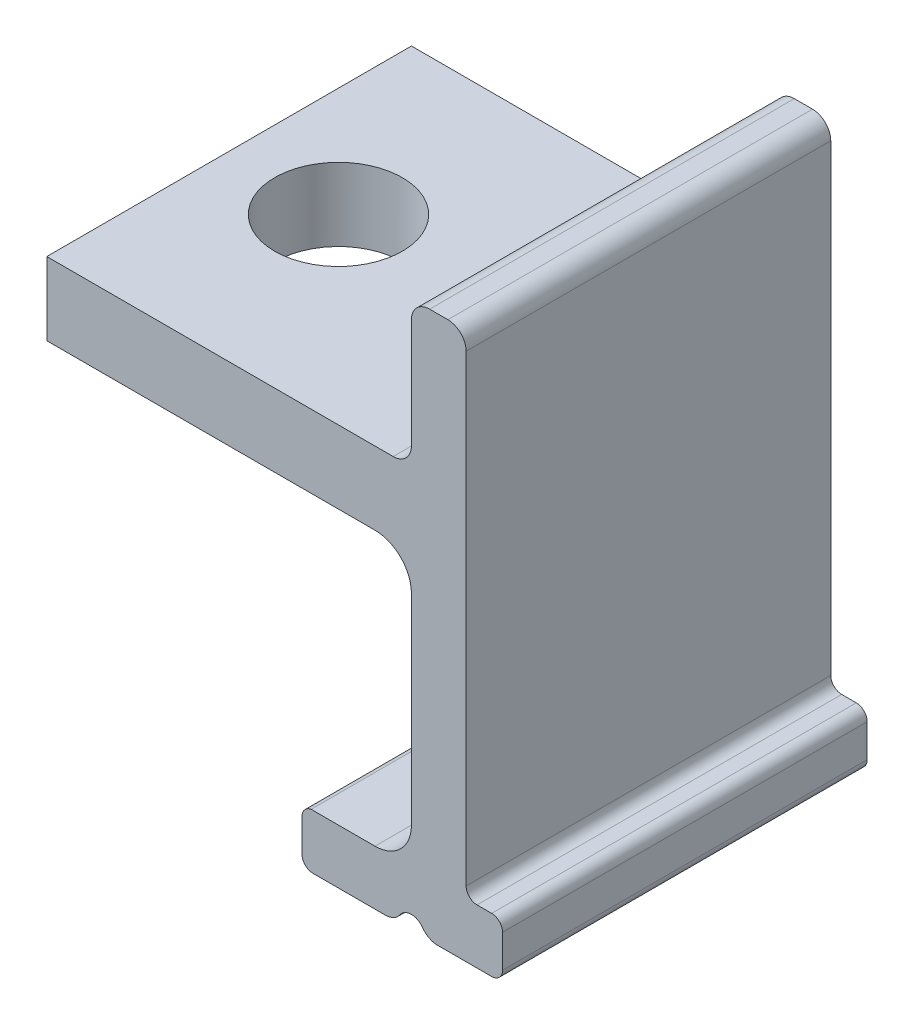
from build123d import *

# Parameters (mm, degrees)
BOSS_EXTRUDE1_DEPTH  = 10
FILLET1_R            = 0.5
M3_CLEARANCE_HOLE1_D = 3.5
CUT_EXTRUDE1_DEPTH   = 10


with BuildPart() as part:
    # Sketch1 → Boss-Extrude1 (new body)
    with BuildSketch(Plane.XY):
        with BuildLine():
            Line((0, 0), (9.5, 0))
            ThreePointArc((9.5, 0), (9.853553391, 0.146446609), (10, 0.5))
            Line((10, 0.5), (10, 3.5))
            ThreePointArc((10, 3.5), (10.146446609, 3.853553391), (10.5, 4))
            Line((10.5, 4), (11, 4))
            ThreePointArc((11, 4), (11.353553391, 3.853553391), (11.5, 3.5))
            Line((11.5, 3.5), (11.5, -9.2))
            ThreePointArc((11.5, -9.2), (11.587867966, -9.412132034), (11.8, -9.5))
            Line((11.8, -9.5), (12.2, -9.5))
            ThreePointArc((12.2, -9.5), (12.412132034, -9.587867966), (12.5, -9.8))
            Line((12.5, -9.8), (12.5, -10.7))
            ThreePointArc((12.5, -10.7), (12.412132034, -10.912132034), (12.2, -11))
            Line((12.2, -11), (10.375, -11))
            ThreePointArc((10.375, -11), (10, -10.625), (9.625, -11))
            Line((9.625, -11), (7.3, -11))
            ThreePointArc((7.3, -11), (7.087867966, -10.912132034), (7, -10.7))
            Line((7, -10.7), (7, -9.8))
            ThreePointArc((7, -9.8), (7.070871215, -9.606350833), (7.25, -9.504196011))
            ThreePointArc((7.25, -9.504196011), (7.429128785, -9.402041189), (7.5, -9.208392022))
            Line((7.5, -9.208392022), (7.5, -2.2))
            ThreePointArc((7.5, -2.2), (7.441421356, -2.058578644), (7.3, -2))
            Line((7.3, -2), (0, -2))
            Line((0, -2), (0, 0))
        make_face()
    extrude(amount=BOSS_EXTRUDE1_DEPTH)

    # Fillet1
    fillet1_edges = [part.edges().sort_by_distance(p)[0] for p in [
        (10.375, -11, 5),
        (9.625, -11, 5),
    ]]
    fillet(fillet1_edges, radius=FILLET1_R)

    # M3 Clearance Hole1 (through all)
    with Locations(Plane(origin=(0, 0, 0), x_dir=(1, 0, 0), z_dir=(0, 1, 0))):
        with Locations((3, -5)):
            Hole(M3_CLEARANCE_HOLE1_D / 2)

    # Sketch4 → Cut-Extrude1 (cut)
    with BuildSketch(Plane.XY.offset(10)):
        with BuildLine():
            Line((7.25, -9.504196011), (9, -9.504196011))
            ThreePointArc((9, -9.504196011), (9.707106781, -9.211302792), (10, -8.504196011))
            Line((10, -8.504196011), (10, -3))
            ThreePointArc((10, -3), (9.707106781, -2.292893219), (9, -2))
            Line((9, -2), (7.5, -2))
            Line((7.5, -2), (7.25, -2))
            Line((7.25, -2), (7.25, -9.504196011))
        make_face()
    extrude(amount=-CUT_EXTRUDE1_DEPTH, mode=Mode.SUBTRACT)


solid = part.part
